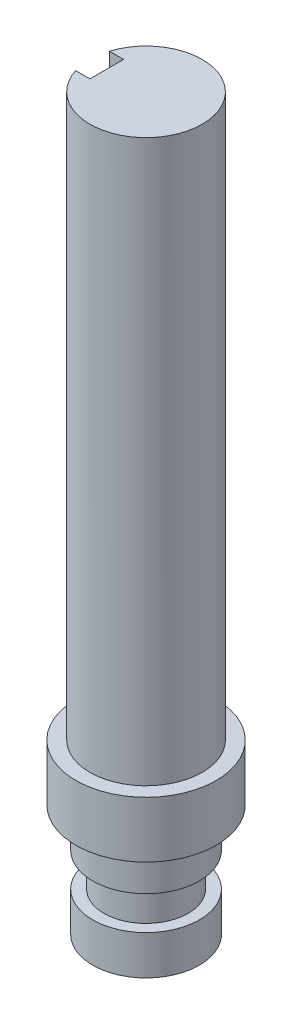
from build123d import *

# Parameters (mm, degrees)
SKETCH1_R           = 10
BOSS_EXTRUDE1_DEPTH = 50
SKETCH2_R           = 12.5
BOSS_EXTRUDE2_DEPTH = 10
SKETCH3_R           = 9.5
BOSS_EXTRUDE3_DEPTH = 7
SKETCH4_R           = 7.5
BOSS_EXTRUDE4_DEPTH = 6
SKETCH5_R           = 9.5
BOSS_EXTRUDE5_DEPTH = 7
SKETCH6_W           = 6
SKETCH6_H           = 6
CUT_EXTRUDE1_DEPTH  = 20


with BuildPart() as part:
    # Sketch1 → Boss-Extrude1 (new, symmetric)
    with BuildSketch(Plane(origin=(0, 0, 0), x_dir=(1, 0, 0), z_dir=(0, 1, 0))):
        with Locations(Location((0, 0, 0), (0, 0, 270))):
            Circle(SKETCH1_R)
    extrude(amount=BOSS_EXTRUDE1_DEPTH, both=True)

    # Sketch2 → Boss-Extrude2 (add)
    with BuildSketch(Plane.XZ.offset(50)):
        with Locations(Location((0, 0, 0), (0, 0, 270))):
            Circle(SKETCH2_R)
    extrude(amount=BOSS_EXTRUDE2_DEPTH)

    # Sketch3 → Boss-Extrude3 (add)
    with BuildSketch(Plane.XZ.offset(60)):
        with Locations(Location((0, 0, 0), (0, 0, 270))):
            Circle(SKETCH3_R)
    extrude(amount=BOSS_EXTRUDE3_DEPTH)

    # Sketch4 → Boss-Extrude4 (add)
    with BuildSketch(Plane.XZ.offset(67)):
        with Locations(Location((0, 0, 0), (0, 0, 270))):
            Circle(SKETCH4_R)
    extrude(amount=BOSS_EXTRUDE4_DEPTH)

    # Sketch5 → Boss-Extrude5 (add)
    with BuildSketch(Plane.XZ.offset(73)):
        with Locations(Location((0, 0, 0), (0, 0, 270))):
            Circle(SKETCH5_R)
    extrude(amount=BOSS_EXTRUDE5_DEPTH)

    # Sketch6 → Cut-Extrude1 (cut)
    with BuildSketch(Plane(origin=(0, 50, 0), x_dir=(1, 0, 0), z_dir=(0, 1, 0))):
        with Locations((-10, 0)):
            Rectangle(SKETCH6_W, SKETCH6_H)
    extrude(amount=-CUT_EXTRUDE1_DEPTH, mode=Mode.SUBTRACT)


solid = part.part
